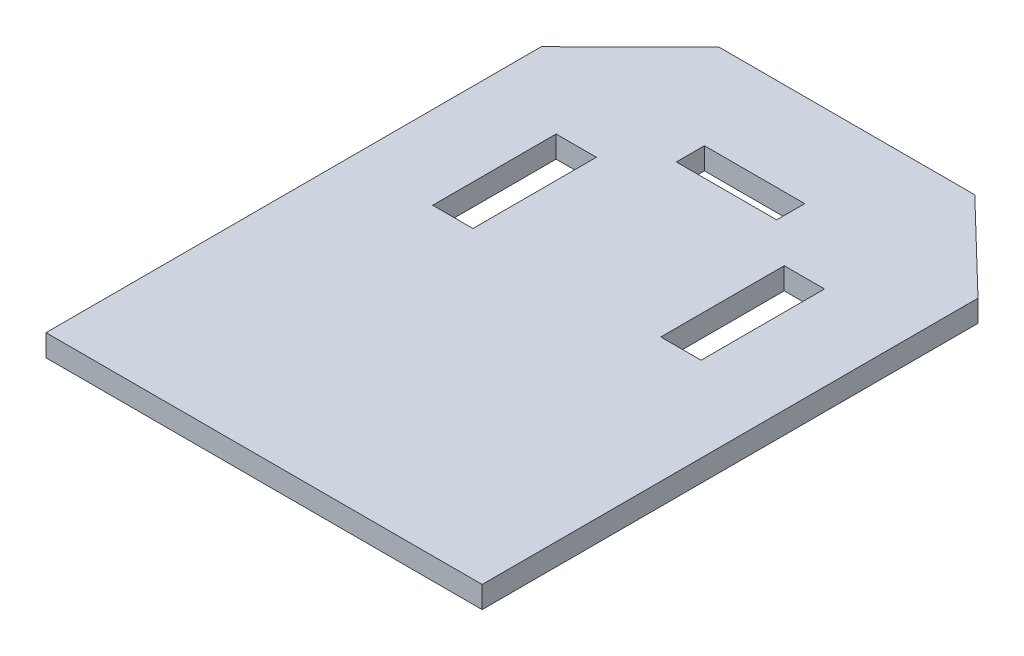
from build123d import *

# Parameters (mm, degrees)
SKETCH1_W           = 9.23810595
SKETCH1_H           = 28.3
SKETCH1_W_2         = 22.995276356
SKETCH1_H_2         = 6.447183695
BOSS_EXTRUDE1_DEPTH = 5


with BuildPart() as part:
    # Sketch1 → Boss-Extrude1 (new body)
    with BuildSketch(Plane(origin=(0, 0, 0), x_dir=(1, 0, 0), z_dir=(0, 1, 0))):
        Polygon((-84.64385089, 36.855414935), (-89.512192258, 32.332884436), (-89.512192258, -81.365540516), (10.487807742, -81.365540516), (10.487807742, 32.332884436), (-10.408953914, 52.490004223), (-69.009261602, 52.490004223), align=None)
        with Locations((-65.864023501, 2.411444329)):
            Rectangle(SKETCH1_W, SKETCH1_H, mode=Mode.SUBTRACT)
        with Locations((-39.648008145, 28.020058308)):
            Rectangle(SKETCH1_W_2, SKETCH1_H_2, mode=Mode.SUBTRACT)
        with Locations((-13.554192015, 2.411444329)):
            Rectangle(SKETCH1_W, SKETCH1_H, mode=Mode.SUBTRACT)
    extrude(amount=BOSS_EXTRUDE1_DEPTH)


solid = part.part
